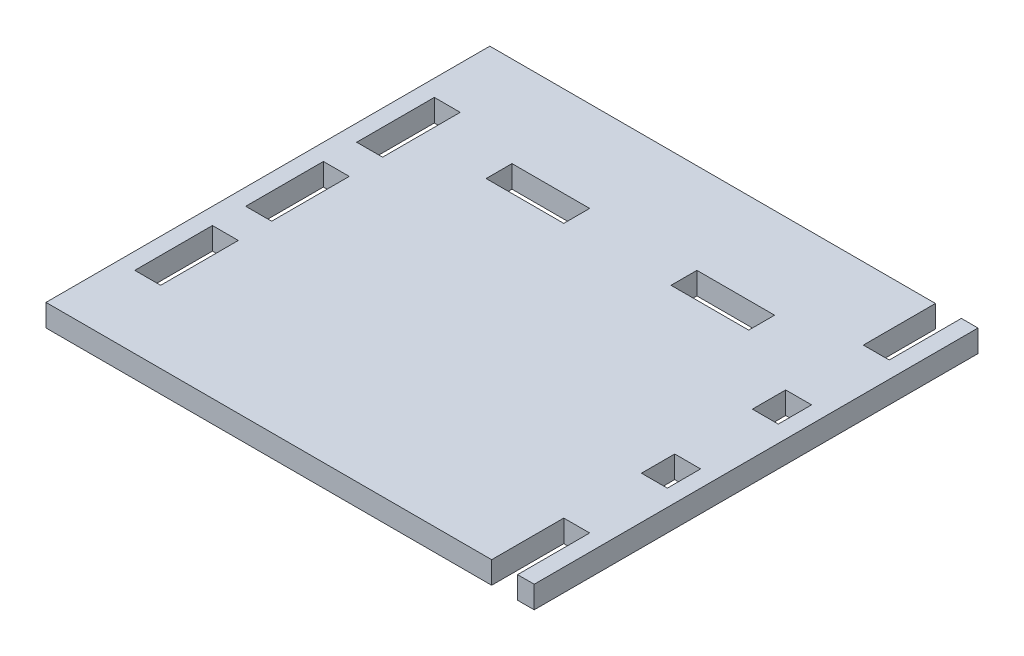
from build123d import *

# Parameters (mm, degrees)
SKETCH_3_W          = 66
SKETCH_3_H          = 60
EXTRUDE_1_DEPTH     = 3
SKETCH_1_W          = 3.5
SKETCH_1_H          = 10.5
SKETCH_1_W_2        = 10.5
SKETCH_1_H_2        = 3.5
SKETCH_1_H_3        = 9.75
SKETCH_1_H_4        = 4.5
CUT_EXTRUDE_1_DEPTH = 49.597691494


with BuildPart() as part:
    # Эскиз3 → Бобышка-Вытянуть1 (new body)
    with BuildSketch(Plane(origin=(0, 0, 0), x_dir=(1, 0, 0), z_dir=(0, 1, 0))):
        with Locations((0, 5.54905932)):
            Rectangle(SKETCH_3_W, SKETCH_3_H)
    extrude(amount=EXTRUDE_1_DEPTH)

    # Эскиз1 → Вырез-Вытянуть1 (cut, through all)
    with BuildSketch(Plane(origin=(0, 0, 0), x_dir=(1, 0, 0), z_dir=(0, 1, 0))):
        with Locations((-29, 5.54905932)):
            Rectangle(SKETCH_1_W, SKETCH_1_H)
        with Locations((-29, 20.54905932)):
            Rectangle(SKETCH_1_W, SKETCH_1_H)
        with Locations((-29, -9.45094068)):
            Rectangle(SKETCH_1_W, SKETCH_1_H)
        with Locations((12.5, 21.54905932)):
            Rectangle(SKETCH_1_W_2, SKETCH_1_H_2)
        with Locations((29, -19.57594068)):
            Rectangle(SKETCH_1_W, SKETCH_1_H_3)
        with Locations((29, 13.04905932)):
            Rectangle(SKETCH_1_W, SKETCH_1_H_4)
        with Locations((29, -1.95094068)):
            Rectangle(SKETCH_1_W, SKETCH_1_H_4)
        with Locations((29, 30.67405932)):
            Rectangle(SKETCH_1_W, SKETCH_1_H_3)
        with Locations((-12.5, 21.54905932)):
            Rectangle(SKETCH_1_W_2, SKETCH_1_H_2)
    extrude(amount=CUT_EXTRUDE_1_DEPTH, mode=Mode.SUBTRACT)


solid = part.part
